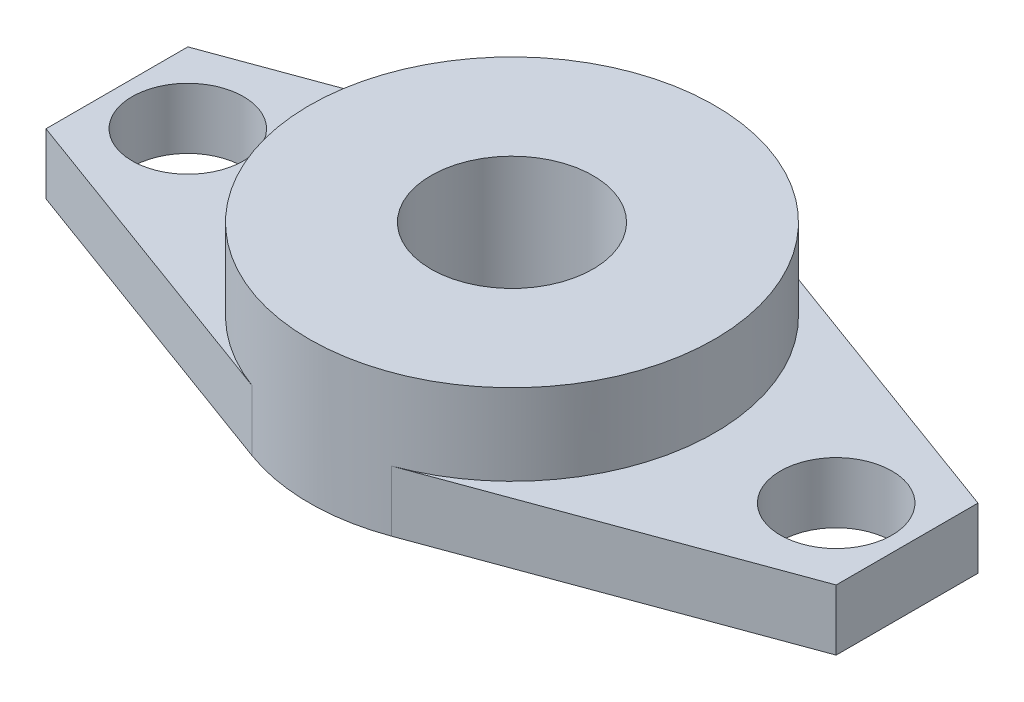
from build123d import *

# Parameters (mm, degrees)
SKETCH_1_R      = 2.75
SKETCH_1_R_2    = 4
EXTRUDE_1_DEPTH = 3
SKETCH_2_R      = 10
SKETCH_2_R_2    = 4
EXTRUDE_2_DEPTH = 4


with BuildPart() as part:
    # 草图1 → 凸台-拉伸1 (new body)
    with BuildSketch(Plane(origin=(0, 0, 0), x_dir=(1, 0, 0), z_dir=(0, 1, 0))):
        with BuildLine():
            Line((-19.5, 3.5), (-19.5, -3.5))
            Line((-19.5, -3.5), (-3.443077457, -9.388568455))
            ThreePointArc((-3.443077457, -9.388568455), (0, -10), (3.443077457, -9.388568455))
            Line((3.443077457, -9.388568455), (19.5, -3.5))
            Line((19.5, -3.5), (19.5, 3.5))
            Line((19.5, 3.5), (3.443077457, 9.388568455))
            ThreePointArc((3.443077457, 9.388568455), (0, 10), (-3.443077457, 9.388568455))
            Line((-3.443077457, 9.388568455), (-19.5, 3.5))
        make_face()
        with Locations(Location((-16, 0, 0), (0, 0, 270))):
            Circle(SKETCH_1_R, mode=Mode.SUBTRACT)
        with Locations(Location((0, 0, 0), (0, 0, 270))):
            Circle(SKETCH_1_R_2, mode=Mode.SUBTRACT)
        with Locations(Location((16, 0, 0), (0, 0, 90))):
            Circle(SKETCH_1_R, mode=Mode.SUBTRACT)
    extrude(amount=EXTRUDE_1_DEPTH)

    # 草图2 → 凸台-拉伸2 (add)
    with BuildSketch(Plane(origin=(0, 3, 0), x_dir=(1, 0, 0), z_dir=(0, 1, 0))):
        with Locations(Location((0, 0, 0), (0, 0, 110.139543726))):
            Circle(SKETCH_2_R)
        with Locations(Location((0, 0, 0), (0, 0, 270))):
            Circle(SKETCH_2_R_2, mode=Mode.SUBTRACT)
    extrude(amount=EXTRUDE_2_DEPTH)


solid = part.part
